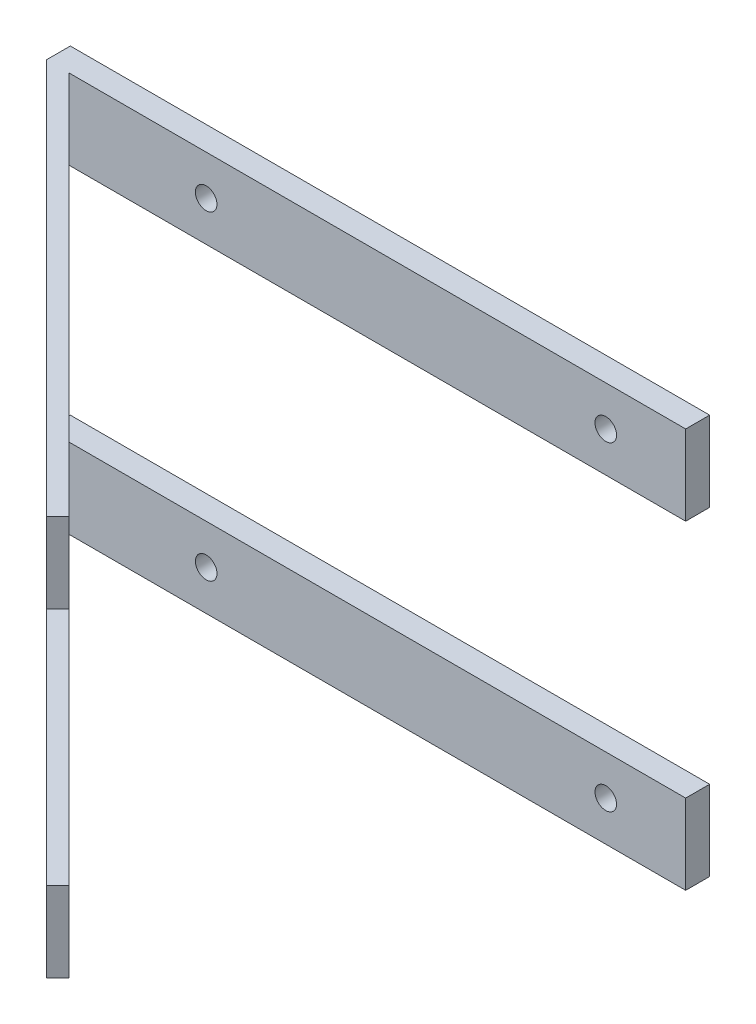
from build123d import *

# Parameters (mm, degrees)
CROQUIS1_W                              = 80
CROQUIS1_H                              = 10
SALIENTE_EXTRUIR1_DEPTH                 = 3
SALIENTE_EXTRUIR1_2_DEPTH               = 3
SALIENTE_EXTRUIR2_DEPTH                 = 10
SALIENTE_EXTRUIR3_DEPTH                 = 10
CROQUIS8_W                              = 1.35
CROQUIS8_H                              = 3
TALADRO_DE_MARGEN_PARA_M2_52_AT_2_COUNT = 2
TALADRO_DE_MARGEN_PARA_M2_52_AT_2_PITCH = 50
TALADRO_DE_MARGEN_PARA_M2_52_AT_3_COUNT = 2
TALADRO_DE_MARGEN_PARA_M2_52_AT_3_PITCH = 64.031242374
TALADRO_DE_MARGEN_PARA_M2_52_AT_4_COUNT = 2
TALADRO_DE_MARGEN_PARA_M2_52_AT_4_PITCH = 40


with BuildPart() as part:
    # Croquis1 → Saliente-Extruir1 (new body)
    with BuildSketch(Plane.XY):
        with Locations((0, 45)):
            Rectangle(CROQUIS1_W, CROQUIS1_H)
    extrude(amount=SALIENTE_EXTRUIR1_DEPTH)

    # Croquis3 → Saliente-Extruir3 (add)
    with BuildSketch(Plane(origin=(0, 50, 0), x_dir=(1, 0, 0), z_dir=(0, 1, 0))):
        Polygon((-40, -3), (9.497474683, -52.497474683), (10.911688245, -51.083261121), (-37.171572875, -3), align=None)
    extrude(amount=-SALIENTE_EXTRUIR3_DEPTH)

    # Croquis8 → Taladro de margen para M2.52 (revolve, cut)
    with BuildSketch(Plane(origin=(-20, 45, 3), x_dir=(0, -1, 0), z_dir=(1, 0, 0))):
        with Locations((0.675, 1.5)):
            Rectangle(CROQUIS8_W, CROQUIS8_H)
    taladro_de_margen_para_m2_52 = revolve(axis=Axis((-20, 45, 9.35), (0, 0, -1)), mode=Mode.SUBTRACT)

    # Taladro de margen para M2.52 at 2: Taladro de margen para M2.52 ×2
    with Locations(*[(i * TALADRO_DE_MARGEN_PARA_M2_52_AT_2_PITCH, 0, 0) for i in range(1, TALADRO_DE_MARGEN_PARA_M2_52_AT_2_COUNT)]):
        add(taladro_de_margen_para_m2_52, mode=Mode.SUBTRACT)


with BuildPart() as body_2:
    # Croquis1 → Saliente-Extruir1 2 (new body)
    with BuildSketch(Plane.XY):
        with Locations((0, 5)):
            Rectangle(CROQUIS1_W, CROQUIS1_H)
    extrude(amount=SALIENTE_EXTRUIR1_2_DEPTH)

    # Croquis2 → Saliente-Extruir2 (add)
    with BuildSketch(Plane.XZ):
        Polygon((-40, 3), (9.497474683, 52.497474683), (10.911688245, 51.083261121), (-37.171572875, 3), align=None)
    extrude(amount=-SALIENTE_EXTRUIR2_DEPTH)

    # Taladro de margen para M2.52 at 3: Taladro de margen para M2.52 ×2
    with Locations(*[Vector(0.7808688094430303, -0.6246950475544244, 0) * (i * TALADRO_DE_MARGEN_PARA_M2_52_AT_3_PITCH) for i in range(1, TALADRO_DE_MARGEN_PARA_M2_52_AT_3_COUNT)]):
        add(taladro_de_margen_para_m2_52, mode=Mode.SUBTRACT)

    # Taladro de margen para M2.52 at 4: Taladro de margen para M2.52 ×2
    with Locations(*[(0, -i * TALADRO_DE_MARGEN_PARA_M2_52_AT_4_PITCH, 0) for i in range(1, TALADRO_DE_MARGEN_PARA_M2_52_AT_4_COUNT)]):
        add(taladro_de_margen_para_m2_52, mode=Mode.SUBTRACT)


solid = Compound([part.part, body_2.part])
